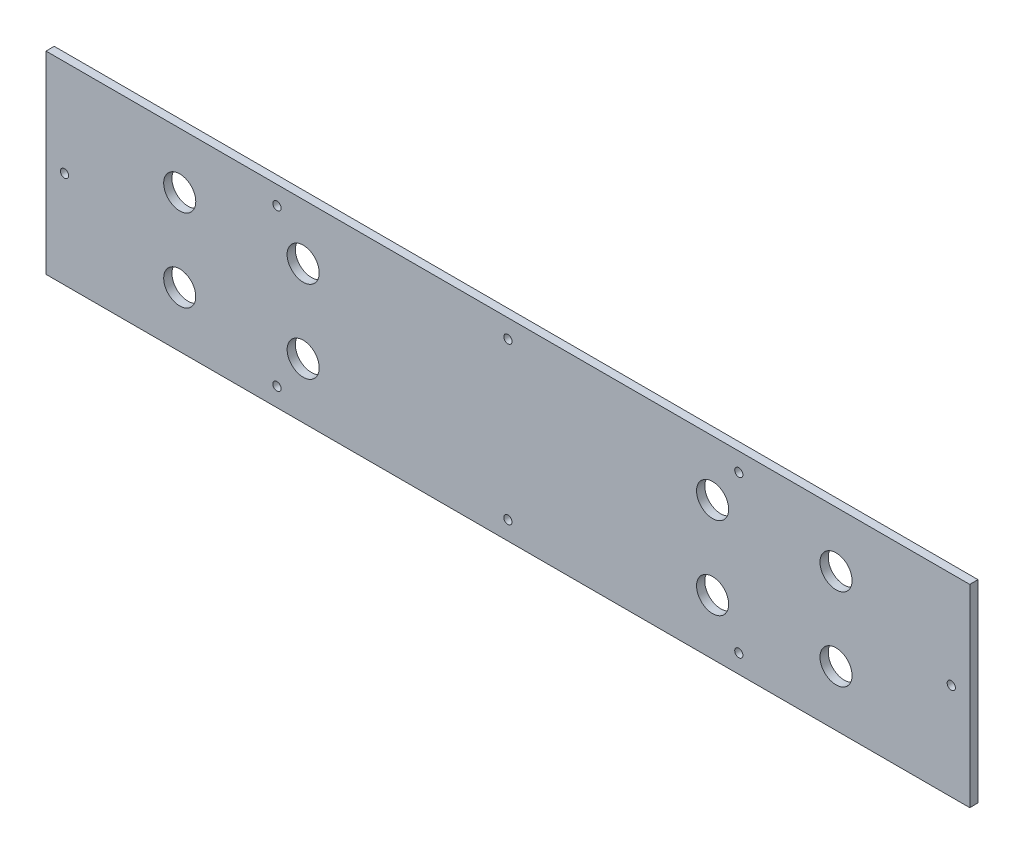
from build123d import *

# Parameters (mm, degrees)
SCHIZZO1_W                   = 449
SCHIZZO1_H                   = 94
SCHIZZO1_R                   = 7.8
SCHIZZO1_R_2                 = 2
ESTRUSIONE_ESTRUSIONE1_DEPTH = 4


with BuildPart() as part:
    # Schizzo1 → Estrusione-Estrusione1 (new body)
    with BuildSketch(Plane.XY):
        with Locations((-224.5, 47)):
            Rectangle(SCHIZZO1_W, SCHIZZO1_H)
        with Locations(Location((-384, 27, 0), (0, 0, 180))):
            Circle(SCHIZZO1_R, mode=Mode.SUBTRACT)
        with Locations((-9, 47)):
            Circle(SCHIZZO1_R_2, mode=Mode.SUBTRACT)
        with Locations((-224.5, 85)):
            Circle(SCHIZZO1_R_2, mode=Mode.SUBTRACT)
        with Locations(Location((-440, 47, 0), (0, 0, 180))):
            Circle(SCHIZZO1_R_2, mode=Mode.SUBTRACT)
        with Locations(Location((-224.5, 9, 0), (0, 0, 180))):
            Circle(SCHIZZO1_R_2, mode=Mode.SUBTRACT)
        with Locations((-324, 27)):
            Circle(SCHIZZO1_R, mode=Mode.SUBTRACT)
        with Locations(Location((-324, 67, 0), (0, 0, 180))):
            Circle(SCHIZZO1_R, mode=Mode.SUBTRACT)
        with Locations((-336.75, 85)):
            Circle(SCHIZZO1_R_2, mode=Mode.SUBTRACT)
        with Locations((-384, 67)):
            Circle(SCHIZZO1_R, mode=Mode.SUBTRACT)
        with Locations(Location((-336.75, 9, 0), (0, 0, 180))):
            Circle(SCHIZZO1_R_2, mode=Mode.SUBTRACT)
        with Locations((-112.25, 9)):
            Circle(SCHIZZO1_R_2, mode=Mode.SUBTRACT)
        with Locations(Location((-112.25, 85, 0), (0, 0, 180))):
            Circle(SCHIZZO1_R_2, mode=Mode.SUBTRACT)
        with Locations((-65, 67)):
            Circle(SCHIZZO1_R, mode=Mode.SUBTRACT)
        with Locations((-65, 27)):
            Circle(SCHIZZO1_R, mode=Mode.SUBTRACT)
        with Locations(Location((-125, 27, 0), (0, 0, 180))):
            Circle(SCHIZZO1_R, mode=Mode.SUBTRACT)
        with Locations(Location((-125, 67, 0), (0, 0, 180))):
            Circle(SCHIZZO1_R, mode=Mode.SUBTRACT)
    extrude(amount=ESTRUSIONE_ESTRUSIONE1_DEPTH)


solid = part.part
